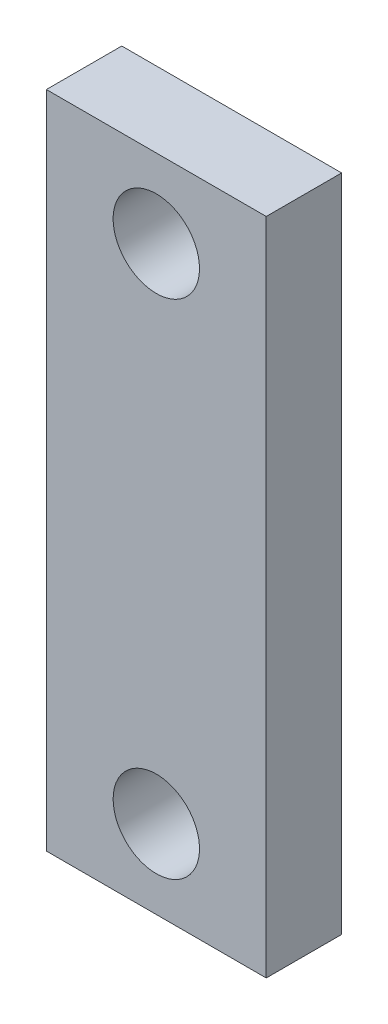
from build123d import *

# Parameters (mm, degrees)
SKETCH_1_W      = 14
SKETCH_1_H      = 42
SKETCH_1_R      = 2.75
EXTRUDE_1_DEPTH = 4.8


with BuildPart() as part:
    # 草图1 → 凸台-拉伸1 (new body)
    with BuildSketch(Plane.XY):
        Rectangle(SKETCH_1_W, SKETCH_1_H)
        with Locations((0, 16)):
            Circle(SKETCH_1_R, mode=Mode.SUBTRACT)
        with Locations(Location((0, -16, 0), (0, 0, 180))):
            Circle(SKETCH_1_R, mode=Mode.SUBTRACT)
    extrude(amount=EXTRUDE_1_DEPTH)


solid = part.part
